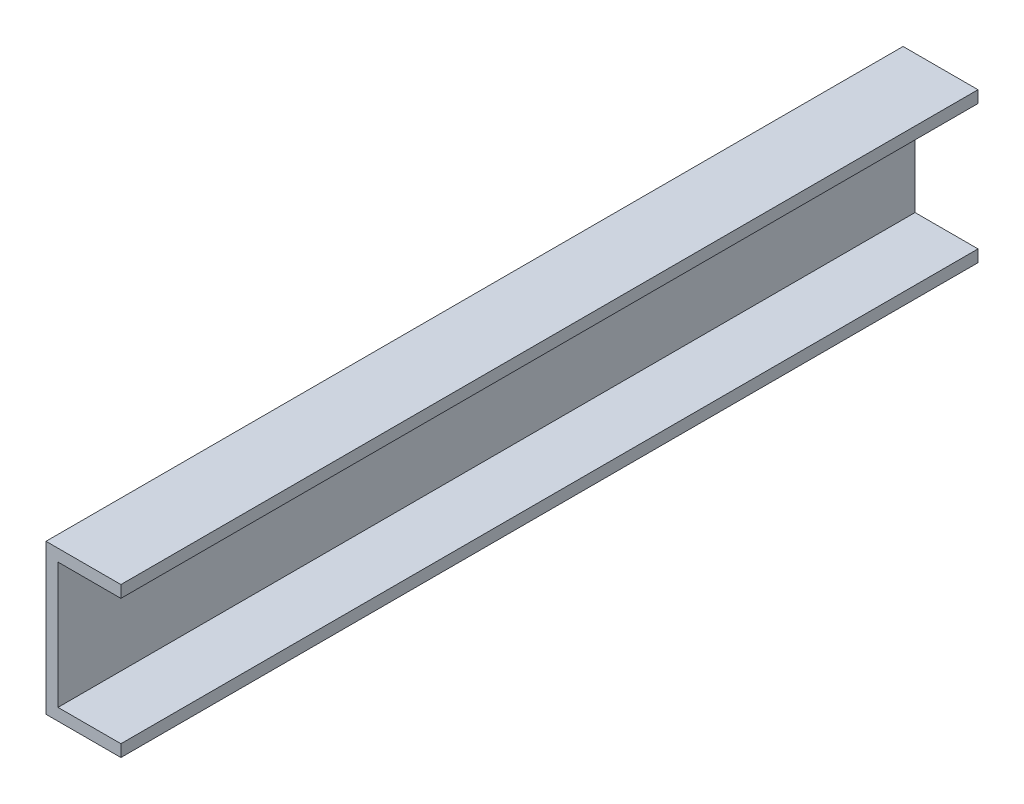
from build123d import *

# Parameters (mm, degrees)
BOSS_EXTRUDE1_DEPTH = 572


with BuildPart() as part:
    # Sketch1 → Boss-Extrude1 (new body)
    with BuildSketch(Plane.XY):
        Polygon((0, 0), (0, -100), (50, -100), (50, -92), (8, -92), (8, -8), (50, -8), (50, 0), align=None)
    extrude(amount=BOSS_EXTRUDE1_DEPTH)


solid = part.part
